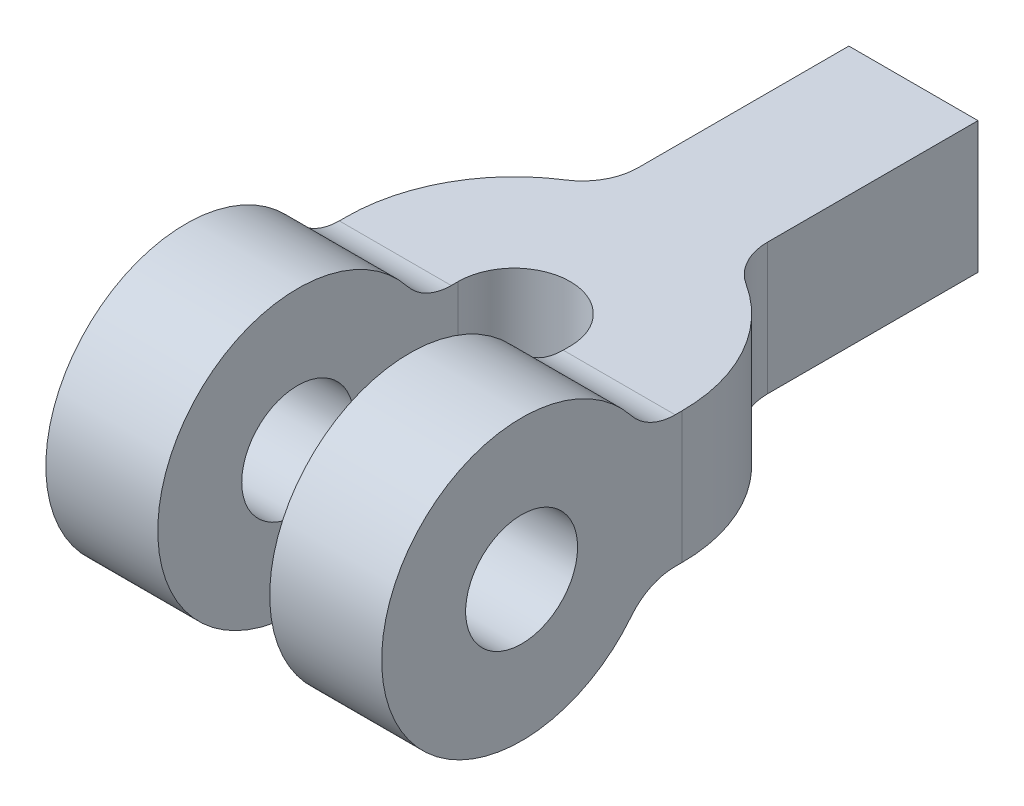
from build123d import *

# Parameters (mm, degrees)
SKETCH2_W           = 120
SKETCH2_H           = 250
BOSS_EXTRUDE1_DEPTH = 100
SKETCH4_R           = 20
CUT_EXTRUDE1_DEPTH  = 100
SKETCH5_R           = 20
CUT_EXTRUDE5_DEPTH  = 201.062490237
SCALE1_SCALE        = 0.35


with BuildPart() as part:
    # Sketch2 → Boss-Extrude1 (new body)
    with BuildSketch(Plane(origin=(0, 0, 0), x_dir=(1, 0, 0), z_dir=(0, 1, 0))):
        Rectangle(SKETCH2_W, SKETCH2_H)
    extrude(amount=BOSS_EXTRUDE1_DEPTH)

    # Sketch4 → Cut-Extrude1 (cut)
    with BuildSketch(Plane(origin=(0, 100, 0), x_dir=(1, 0, 0), z_dir=(0, 1, 0))):
        with BuildLine():
            Line((-60, 125), (-60, -17.644609552))
            ThreePointArc((-60, -17.644609552), (-52.622366518, 11.180492718), (-32.303782241, 32.916893747))
            ThreePointArc((-32.303782241, 32.916893747), (-25.530920786, 40.16236081), (-23.071709655, 49.770728302))
            Line((-23.071709655, 49.770728302), (-23.071709655, 125))
            Line((-23.071709655, 125), (-60, 125))
        make_face()
        with BuildLine():
            ThreePointArc((32.303782241, 32.916893747), (52.62236667, 11.18049244), (60, -17.644610185))
            Line((60, -17.644610185), (60, 125))
            Line((60, 125), (23.071709655, 125))
            Line((23.071709655, 125), (23.071709655, 49.770728302))
            ThreePointArc((23.071709655, 49.770728302), (25.530920786, 40.16236081), (32.303782241, 32.916893747))
        make_face()
        with Locations((0, -17.644609919)):
            Circle(SKETCH4_R)
        with BuildLine():
            Line((-20, -17.644609919), (-20, -74.213152414))
            ThreePointArc((-20, -74.213152414), (0, -77.644609919), (20, -74.213152414))
            Line((20, -74.213152414), (20, -17.644609919))
            ThreePointArc((20, -17.644609919), (0, -37.644609919), (-20, -17.644609919))
        make_face()
        with BuildLine():
            Line((-20, -74.213152414), (-20, -125))
            Line((-20, -125), (20, -125))
            Line((20, -125), (20, -74.213152414))
            ThreePointArc((20, -74.213152414), (0, -77.644609919), (-20, -74.213152414))
        make_face()
    extrude(amount=-CUT_EXTRUDE1_DEPTH, mode=Mode.SUBTRACT)

    # Sketch5 → Cut-Extrude5 (cut, through all)
    # profile 1 of 2: a face of its own
    with BuildSketch(Plane(origin=(60, 0, 0), x_dir=(0, 0, -1), z_dir=(1, 0, 0))):
        Polygon((125, 100), (49.770728302, 100), (32.916893747, 100), (-17.644609919, 100), (-125, 100), (-125, 0), (-17.644609919, 0), (32.916893747, 0), (49.770728302, 0), (125, 0), align=None)
        with BuildLine():
            Line((125, 73.474979738), (125, 26.525020262))
            Line((125, 26.525020262), (-20.137206262, 26.525020262))
            ThreePointArc((-20.137206262, 26.525020262), (-28.84270867, 24.530970051), (-35.812290187, 18.946443044))
            ThreePointArc((-35.812290187, 18.946443044), (-125, 50), (-35.812290187, 81.053556956))
            ThreePointArc((-35.812290187, 81.053556956), (-28.84270867, 75.469029949), (-20.137206262, 73.474979738))
            Line((-20.137206262, 73.474979738), (125, 73.474979738))
        make_face(mode=Mode.SUBTRACT)
    # profile 2 of 2: a face of its own
    with BuildSketch(Plane(origin=(60, 0, 0), x_dir=(0, 0, -1), z_dir=(1, 0, 0))):
        with Locations((-75, 50)):
            Circle(SKETCH5_R)
    extrude(amount=-CUT_EXTRUDE5_DEPTH, mode=Mode.SUBTRACT)


with BuildPart() as cut_extrude5_kept_piece:
    # of the separate pieces the step leaves, the one the design keeps (cut_extrude5_pieces_kept)
    add(part.part.solids().sort_by_distance((23.071709655, 73.474979738, -125))[0])


with BuildPart() as cut_extrude5_kept_piece_1:
    # Scale1: scaled about (0, 50, 23.23209908)
    add(cut_extrude5_kept_piece.part.scale(SCALE1_SCALE).moved(Location((0, 32.5, 15.100864402))))


solid = cut_extrude5_kept_piece_1.part
